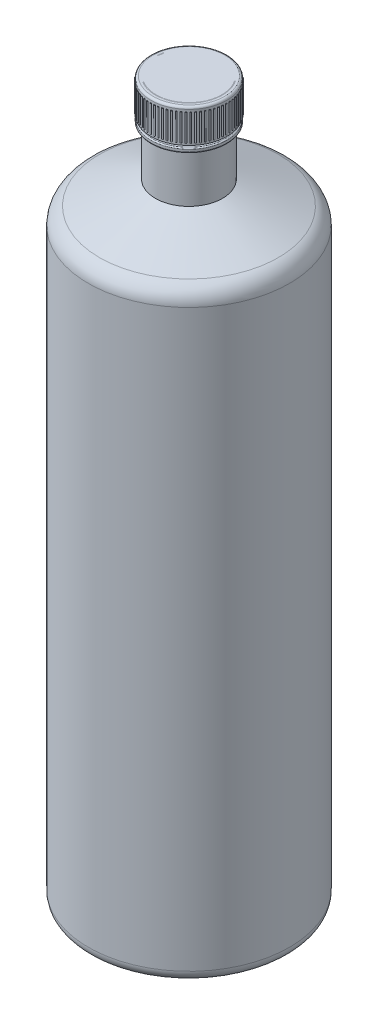
from build123d import *

# Parameters (mm, degrees)
BOSS_EXTRUDE1_START = -1
SKETCH3_R           = 0.3
BOSS_EXTRUDE1_DEPTH = 12
CIRPATTERN1_COUNT   = 69
FILLET1_R           = 1
BOSS_EXTRUDE2_START = 1
SKETCH4_R           = 17
SKETCH4_R_2         = 15.1
BOSS_EXTRUDE2_DEPTH = 2
FILLET2_R           = 0.5


with BuildPart() as part:
    # Sketch1 → Revolve-Thin1 (revolve)
    with BuildSketch(Plane.XY, mode=Mode.PRIVATE) as revolve_thin1_sk:
        with BuildLine():
            Line((0, 0), (40.000012172, 0))
            ThreePointArc((40.000012172, 0), (43.539444621, 1.46836894), (45, 5.011032824))
            Line((45, 5.011032824), (45, 262.076631232))
            ThreePointArc((45, 262.076631232), (43.635448985, 266.584165268), (40.000012172, 269.578069366))
            Line((40.000012172, 269.578069366), (15, 280))
            Line((15, 280), (15, 320))
            Line((15, 320), (14.7, 320))
            Line((14.7, 320), (14.7, 279.80003883))
            Line((14.7, 279.80003883), (39.884577927, 269.301166973))
            ThreePointArc((39.884577927, 269.301166973), (43.385818985, 266.417777579), (44.7, 262.076631232))
            Line((44.7, 262.076631232), (44.7, 5.010696719))
            ThreePointArc((44.7, 5.010696719), (43.327193756, 1.680382144), (40.000012172, 0.3))
            Line((40.000012172, 0.3), (0, 0.3))
            Line((0, 0.3), (0, 0))
        make_face()
    revolve(revolve_thin1_sk.sketch.rotate(Axis((0, 0, 0), (0, 1, 0)), 90), axis=Axis((0, 0, 0), (0, 1, 0)))


with BuildPart() as body_2:
    # Sketch2 → Revolve1 (revolve)
    with BuildSketch(Plane.XY, mode=Mode.PRIVATE) as revolve1_sk:
        Polygon((17, 320), (17, 305), (15, 305), (15, 318), (0, 318), (0, 320), align=None)
    revolve(revolve1_sk.sketch.rotate(Axis((0, 328.827025099, 0), (0, -1, 0)), 90), axis=Axis((0, 328.827025099, 0), (0, -1, 0)))

    # Sketch3 → Boss-Extrude1 (add)
    with BuildSketch(Plane.XZ.offset(-305).offset(BOSS_EXTRUDE1_START)):
        with Locations((0, 17)):
            Circle(SKETCH3_R)
    boss_extrude1 = extrude(amount=-BOSS_EXTRUDE1_DEPTH)

    # CirPattern1: Boss-Extrude1 ×69 about axis
    cirpattern1_axis = Axis((0, 0, 0), (0, 1, 0))
    for i in range(1, CIRPATTERN1_COUNT):
        add(boss_extrude1.rotate(cirpattern1_axis, i * 360 / CIRPATTERN1_COUNT))

    # Fillet1
    fillet1_edges = [body_2.edges().sort_by_distance(p)[0] for p in [
        (0, 320, -17),
    ]]
    fillet(fillet1_edges, radius=FILLET1_R)


with BuildPart() as body_3:
    # Sketch4 → Boss-Extrude2 (new body)
    with BuildSketch(Plane.XZ.offset(-305).offset(BOSS_EXTRUDE2_START)):
        with Locations(Location((0, 0, 0), (0, 0, 270))):
            Circle(SKETCH4_R)
        with Locations(Location((0, 0, 0), (0, 0, 270))):
            Circle(SKETCH4_R_2, mode=Mode.SUBTRACT)
    extrude(amount=BOSS_EXTRUDE2_DEPTH)

    # Fillet2
    fillet2_edges = [body_3.edges().sort_by_distance(p)[0] for p in [
        (0, 304, 17),
        (0, 302, 17),
    ]]
    fillet(fillet2_edges, radius=FILLET2_R)


solid = Compound([part.part, body_2.part, body_3.part])
